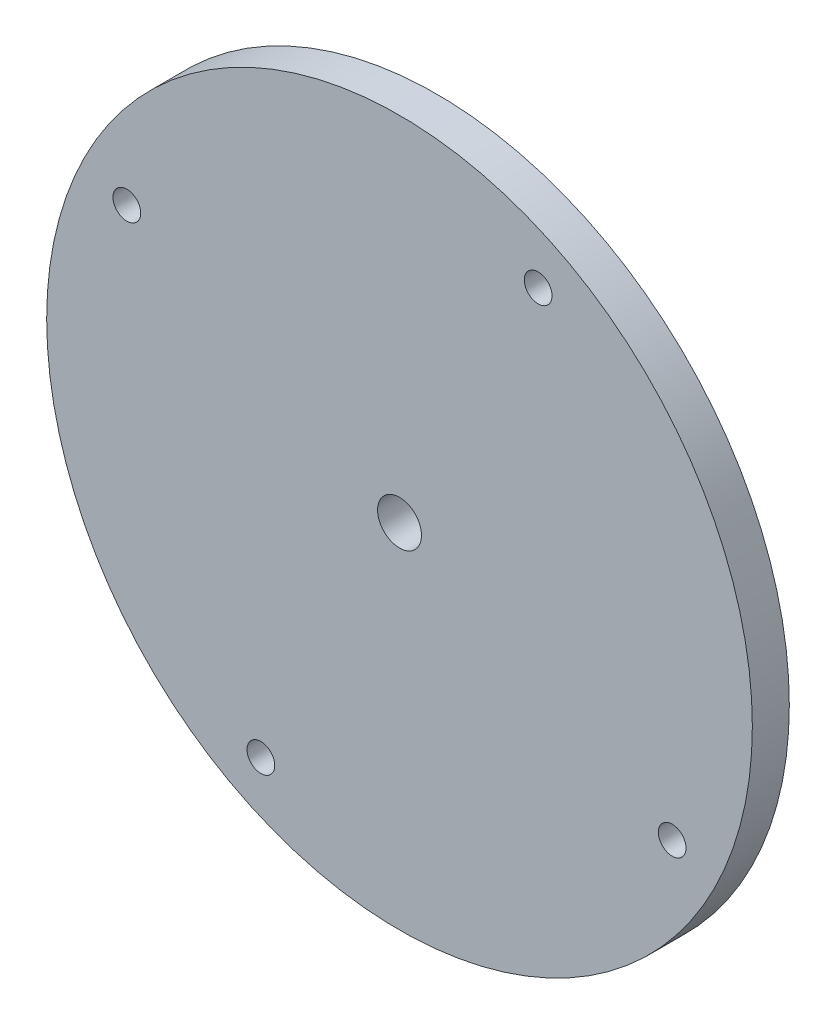
from build123d import *

# Parameters (mm, degrees)
SKETCH1_R           = 3
BOSS_EXTRUDE3_DEPTH = 8
SKETCH2_R           = 4.75
CUT_EXTRUDE1_DEPTH  = 109.271164213


with BuildPart() as part:
    # Sketch1 → Boss-Extrude3 (new body)
    # profile 1 of 5: a face of its own
    with BuildSketch(Plane.XY):
        with BuildLine():
            ThreePointArc((76.35, 0), (53.987602744, 53.987602744), (0, 76.35))
            ThreePointArc((0, 76.35), (-62.014972319, 44.536116897), (-72.348554199, -24.392810524))
            ThreePointArc((-72.348554199, -24.392810524), (-44.536116897, -62.014972319), (0, -76.35))
            ThreePointArc((0, -76.35), (53.987602744, -53.987602744), (76.35, 0))
        make_face()
        Polygon((-27.25, -54.236860279), (-24.5, -59), (-27.25, -63.763139721), (-32.75, -63.763139721), (-35.5, -59), (-32.75, -54.236860279), align=None, mode=Mode.SUBTRACT)
        Polygon((54.236860279, -27.25), (59, -24.5), (63.763139721, -27.25), (63.763139721, -32.75), (59, -35.5), (54.236860279, -32.75), align=None, mode=Mode.SUBTRACT)
        Polygon((-54.236860279, 27.25), (-59, 24.5), (-63.763139721, 27.25), (-63.763139721, 32.75), (-59, 35.5), (-54.236860279, 32.75), align=None, mode=Mode.SUBTRACT)
        Polygon((27.25, 54.236860279), (24.5, 59), (27.25, 63.763139721), (32.75, 63.763139721), (35.5, 59), (32.75, 54.236860279), align=None, mode=Mode.SUBTRACT)
    # profile 2 of 5: a face of its own
    with BuildSketch(Plane.XY):
        Polygon((-63.763139721, 32.75), (-63.763139721, 27.25), (-59, 24.5), (-54.236860279, 27.25), (-54.236860279, 32.75), (-59, 35.5), align=None)
        with Locations((-59, 30)):
            Circle(SKETCH1_R, mode=Mode.SUBTRACT)
    # profile 3 of 5: a face of its own
    with BuildSketch(Plane.XY):
        Polygon((32.75, 63.763139721), (27.25, 63.763139721), (24.5, 59), (27.25, 54.236860279), (32.75, 54.236860279), (35.5, 59), align=None)
        with Locations((30, 59)):
            Circle(SKETCH1_R, mode=Mode.SUBTRACT)
    # profile 4 of 5: a face of its own
    with BuildSketch(Plane.XY):
        Polygon((63.763139721, -32.75), (63.763139721, -27.25), (59, -24.5), (54.236860279, -27.25), (54.236860279, -32.75), (59, -35.5), align=None)
        with Locations((59, -30)):
            Circle(SKETCH1_R, mode=Mode.SUBTRACT)
    # profile 5 of 5: a face of its own
    with BuildSketch(Plane.XY):
        Polygon((-32.75, -63.763139721), (-27.25, -63.763139721), (-24.5, -59), (-27.25, -54.236860279), (-32.75, -54.236860279), (-35.5, -59), align=None)
        with Locations((-30, -59)):
            Circle(SKETCH1_R, mode=Mode.SUBTRACT)
    extrude(amount=BOSS_EXTRUDE3_DEPTH)

    # Sketch2 → Cut-Extrude1 (cut, through all)
    with BuildSketch(Plane.XY.offset(8)):
        Circle(SKETCH2_R)
    extrude(amount=-CUT_EXTRUDE1_DEPTH, mode=Mode.SUBTRACT)


solid = part.part
